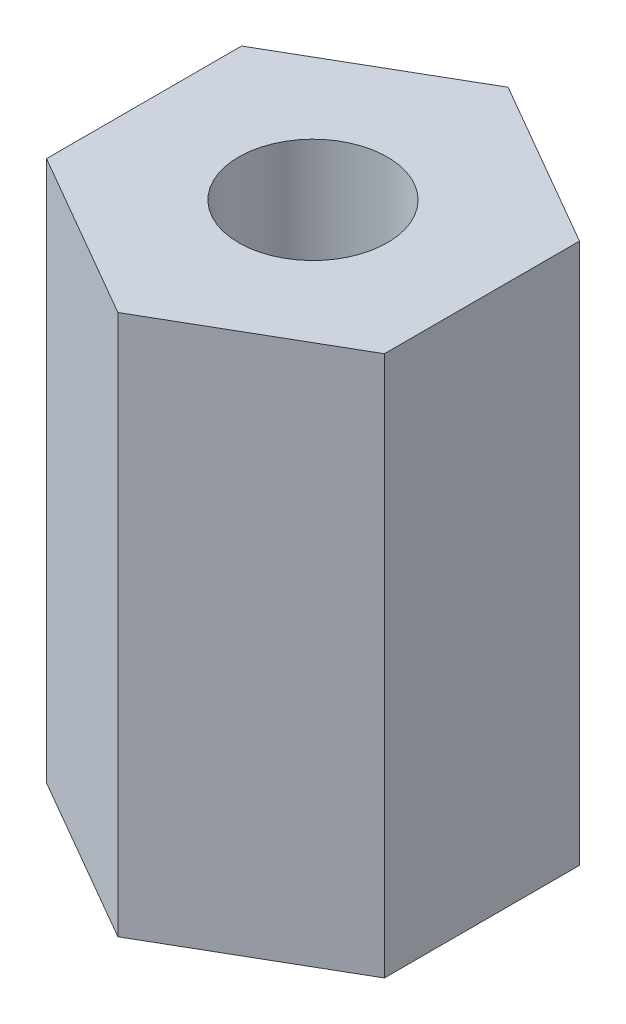
from build123d import *

# Parameters (mm, degrees)
SKETCH1_R           = 1.1
BOSS_EXTRUDE1_DEPTH = 8


with BuildPart() as part:
    # Sketch1 → Boss-Extrude1 (new body)
    with BuildSketch(Plane(origin=(0, 0, 0), x_dir=(1, 0, 0), z_dir=(0, 1, 0))):
        Polygon((0, 2.886751346), (-2.5, 1.443375673), (-2.5, -1.443375673), (0, -2.886751346), (2.5, -1.443375673), (2.5, 1.443375673), align=None)
        with Locations(Location((0, 0, 0), (0, 0, 270))):
            Circle(SKETCH1_R, mode=Mode.SUBTRACT)
    extrude(amount=BOSS_EXTRUDE1_DEPTH)


solid = part.part
